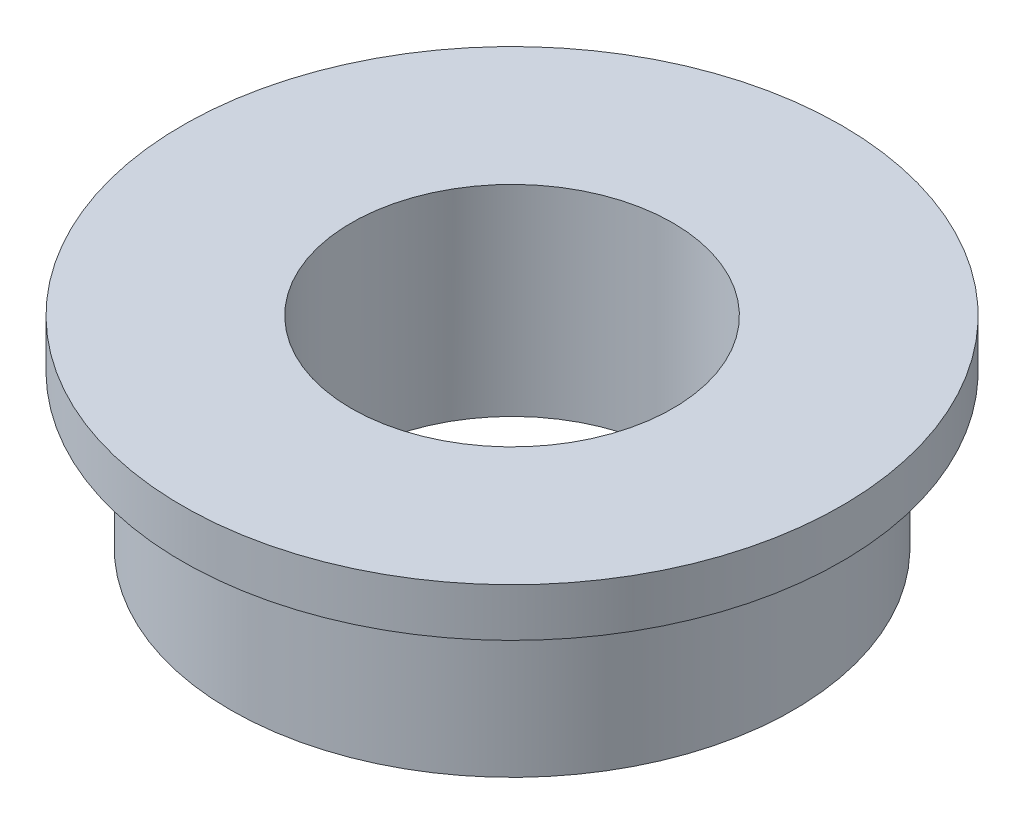
from build123d import *

# Parameters (mm, degrees)
CUT_EXTRUDE_1_REACH = 8.314
SKETCH_3_R          = 2


with BuildPart() as part:
    # 草图2 → 旋转1 (revolve)
    with BuildSketch(Plane.XY, mode=Mode.PRIVATE) as revolve_1_sk:
        Polygon((0, 0), (3.5, 0), (3.5, 1.9), (4.1, 1.9), (4.1, 2.5), (0, 2.5), align=None)
    revolve(revolve_1_sk.sketch.rotate(Axis((0, 0, 0), (0, 1, 0)), 90), axis=Axis((0, 0, 0), (0, 1, 0)))

    # 草图3 → 切除-拉伸1 (cut, up to next)
    with BuildSketch(Plane.XZ, mode=Mode.PRIVATE) as cut_extrude_1_sk1:
        with Locations(Location((0, 0, 0), (0, 0, 270))):
            Circle(SKETCH_3_R)
    cut_extrude_1_tool1 = extrude(cut_extrude_1_sk1.sketch, amount=-CUT_EXTRUDE_1_REACH, mode=Mode.PRIVATE) & part.part
    add(cut_extrude_1_tool1.solids().sort_by_distance((0, 0, 0))[0], mode=Mode.SUBTRACT)


solid = part.part
